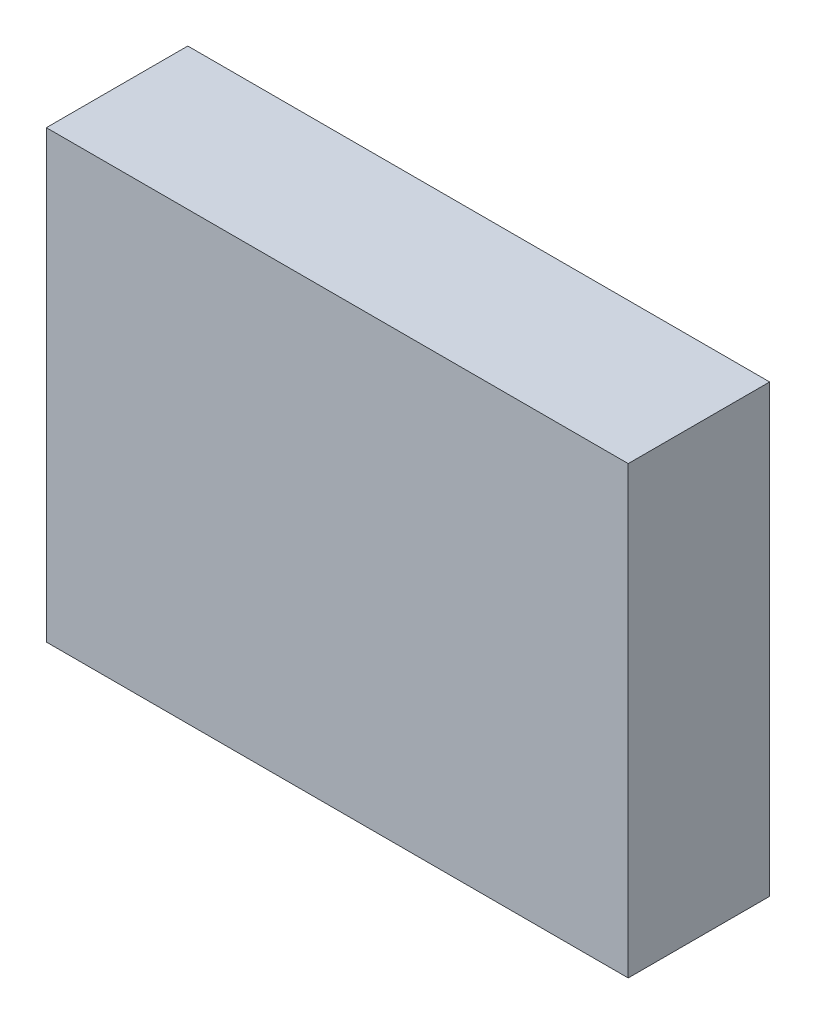
from build123d import *

# Parameters (mm, degrees)
CROQUIS1_W              = 113.92
CROQUIS1_H              = 87.22
SALIENTE_EXTRUIR3_DEPTH = 27.69


with BuildPart() as part:
    # Croquis1 → Saliente-Extruir3 (new body)
    with BuildSketch(Plane.XY):
        Rectangle(CROQUIS1_W, CROQUIS1_H)
    extrude(amount=SALIENTE_EXTRUIR3_DEPTH)


solid = part.part
